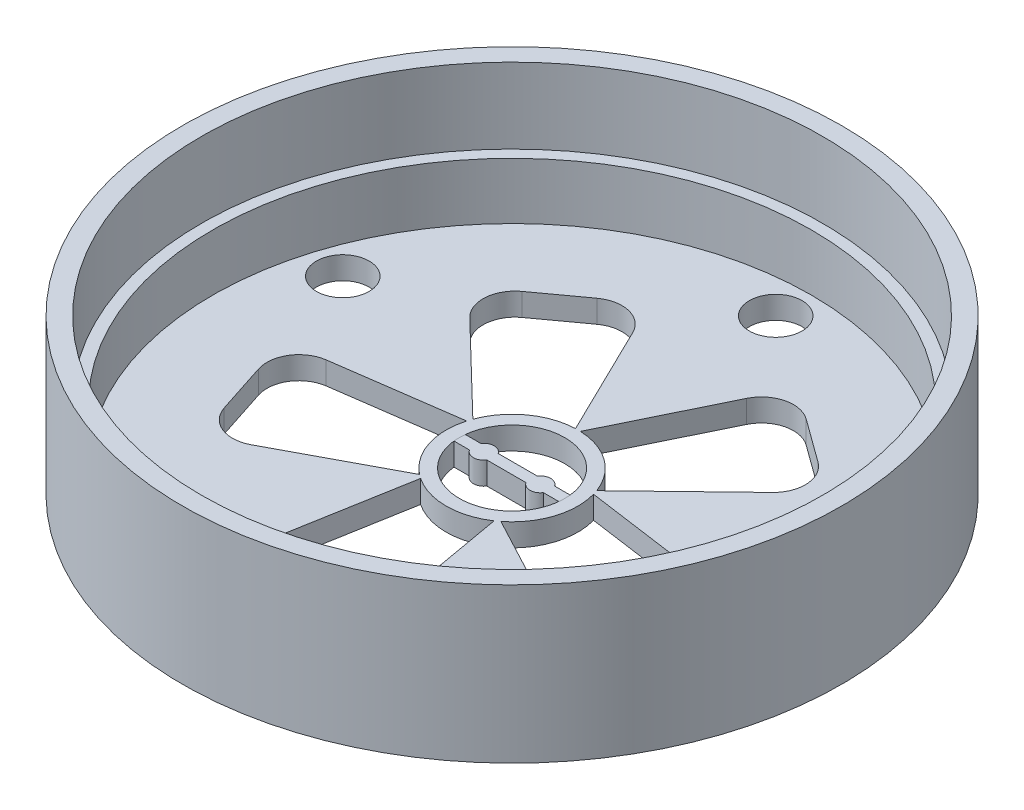
from build123d import *

# Parameters (mm, degrees)
SKETCH1_R           = 111.125
SKETCH1_R_2         = 17.78
SKETCH1_R_3         = 8.89
BOSS_EXTRUDE1_DEPTH = 7.62
SKETCH3_R           = 111.125
SKETCH3_R_2         = 100.965
BOSS_EXTRUDE2_DEPTH = 19.05
SKETCH5_R           = 111.125
SKETCH5_R_2         = 104.775
BOSS_EXTRUDE3_DEPTH = 25.4
SKETCH6_R           = 3.4925
BOSS_EXTRUDE4_DEPTH = 7.62


with BuildPart() as part:
    # Sketch1 → Boss-Extrude1 (new body)
    with BuildSketch(Plane(origin=(0, 0, 0), x_dir=(1, 0, 0), z_dir=(0, 1, 0))):
        with Locations(Location((0, 0, 0), (0, 0, 90))):
            Circle(SKETCH1_R)
        with BuildLine():
            ThreePointArc((-12.390251216, -18.450807565), (0, -22.225), (12.390251216, -18.450807565))
            Line((12.390251216, -18.450807565), (19.673519662, -59.756275487))
            ThreePointArc((19.673519662, -59.756275487), (17.311969731, -68.569699811), (9.042519968, -72.425807565))
            Line((9.042519968, -72.425807565), (-9.042519968, -72.425807565))
            ThreePointArc((-9.042519968, -72.425807565), (-17.311969731, -68.569699811), (-19.673519662, -59.756275487))
            Line((-19.673519662, -59.756275487), (-12.390251216, -18.450807565))
        make_face(mode=Mode.SUBTRACT)
        with BuildLine():
            ThreePointArc((-21.376558956, 6.08221606), (-21.137231075, -6.8679027), (-13.718962575, -17.485442255))
            Line((-13.718962575, -17.485442255), (-50.752143277, -37.176333719))
            ThreePointArc((-50.752143277, -37.176333719), (-59.863966973, -37.653864164), (-66.08674389, -30.980752908))
            Line((-66.08674389, -30.980752908), (-71.675328575, -13.78085783))
            ThreePointArc((-71.675328575, -13.78085783), (-70.563352679, -4.724540918), (-62.911047106, 0.244924427))
            Line((-62.911047106, 0.244924427), (-21.376558956, 6.08221606))
        make_face(mode=Mode.SUBTRACT)
        with BuildLine():
            ThreePointArc((-0.821188781, 22.209823817), (-13.063527232, 17.9804027), (-20.869036378, 7.644209943))
            Line((-20.869036378, 7.644209943), (-51.040069209, 36.780037672))
            ThreePointArc((-51.040069209, 36.780037672), (-54.309936022, 45.29833195), (-49.886373898, 53.278649271))
            Line((-49.886373898, 53.278649271), (-35.255269246, 63.908769032))
            ThreePointArc((-35.255269246, 63.908769032), (-26.298580584, 65.649772943), (-19.207645718, 59.907647107))
            Line((-19.207645718, 59.907647107), (-0.821188781, 22.209823817))
        make_face(mode=Mode.SUBTRACT)
        with BuildLine():
            ThreePointArc((20.869036378, 7.644209943), (13.063527232, 17.9804027), (0.821188781, 22.209823817))
            Line((0.821188781, 22.209823817), (19.207645718, 59.907647107))
            ThreePointArc((19.207645718, 59.907647107), (26.298580584, 65.649772943), (35.255269246, 63.908769032))
            Line((35.255269246, 63.908769032), (49.886373898, 53.278649271))
            ThreePointArc((49.886373898, 53.278649271), (54.309936022, 45.29833195), (51.040069209, 36.780037672))
            Line((51.040069209, 36.780037672), (20.869036378, 7.644209943))
        make_face(mode=Mode.SUBTRACT)
        with BuildLine():
            Line((21.376558956, 6.08221606), (62.911047106, 0.244924427))
            ThreePointArc((62.911047106, 0.244924427), (70.563352679, -4.724540918), (71.675328575, -13.78085783))
            Line((71.675328575, -13.78085783), (66.08674389, -30.980752908))
            ThreePointArc((66.08674389, -30.980752908), (59.863966973, -37.653864164), (50.752143277, -37.176333719))
            Line((50.752143277, -37.176333719), (13.718962575, -17.485442255))
            ThreePointArc((13.718962575, -17.485442255), (21.137231075, -6.8679027), (21.376558956, 6.08221606))
        make_face(mode=Mode.SUBTRACT)
        with Locations(Location((0, 0, 0), (0, 0, 90))):
            Circle(SKETCH1_R_2, mode=Mode.SUBTRACT)
        with Locations(Location((-52.254108929, -71.9216108, 0), (0, 0, 90))):
            Circle(SKETCH1_R_3, mode=Mode.SUBTRACT)
        with Locations(Location((52.254108929, -71.9216108, 0), (0, 0, 90))):
            Circle(SKETCH1_R_3, mode=Mode.SUBTRACT)
        with Locations(Location((-84.548924299, 27.4716108, 0), (0, 0, 90))):
            Circle(SKETCH1_R_3, mode=Mode.SUBTRACT)
        with Locations(Location((84.548924299, 27.4716108, 0), (0, 0, 90))):
            Circle(SKETCH1_R_3, mode=Mode.SUBTRACT)
        with Locations(Location((0, 88.9, 0), (0, 0, 90))):
            Circle(SKETCH1_R_3, mode=Mode.SUBTRACT)
    extrude(amount=BOSS_EXTRUDE1_DEPTH)

    # Sketch3 → Boss-Extrude2 (add)
    with BuildSketch(Plane(origin=(0, 7.62, 0), x_dir=(1, 0, 0), z_dir=(0, 1, 0))):
        with Locations(Location((0, 0, 0), (0, 0, 90))):
            Circle(SKETCH3_R)
        with Locations(Location((0, 0, 0), (0, 0, 90))):
            Circle(SKETCH3_R_2, mode=Mode.SUBTRACT)
    extrude(amount=BOSS_EXTRUDE2_DEPTH)

    # Sketch5 → Boss-Extrude3 (add)
    with BuildSketch(Plane(origin=(0, 26.67, 0), x_dir=(1, 0, 0), z_dir=(0, 1, 0))):
        with Locations(Location((0, 0, 0), (0, 0, 90))):
            Circle(SKETCH5_R)
        with Locations(Location((0, 0, 0), (0, 0, 270))):
            Circle(SKETCH5_R_2, mode=Mode.SUBTRACT)
    extrude(amount=BOSS_EXTRUDE3_DEPTH)


with BuildPart() as body_2:
    # Sketch6 → Boss-Extrude4 (new body)
    with BuildSketch(Plane(origin=(0, 7.62, 0), x_dir=(1, 0, 0), z_dir=(0, 1, 0))):
        with Locations((9.525, 0)):
            Circle(SKETCH6_R)
        with Locations((-9.525, 0)):
            Circle(SKETCH6_R)
        with BuildLine():
            Line((-17.677651852, 1.905), (17.677651852, 1.905))
            ThreePointArc((17.677651852, 1.905), (17.78, 0), (17.677651852, -1.905))
            Line((17.677651852, -1.905), (-17.677651852, -1.905))
            ThreePointArc((-17.677651852, -1.905), (-17.78, 0), (-17.677651852, 1.905))
        make_face()
    extrude(amount=-BOSS_EXTRUDE4_DEPTH)


solid = Compound([part.part, body_2.part])
